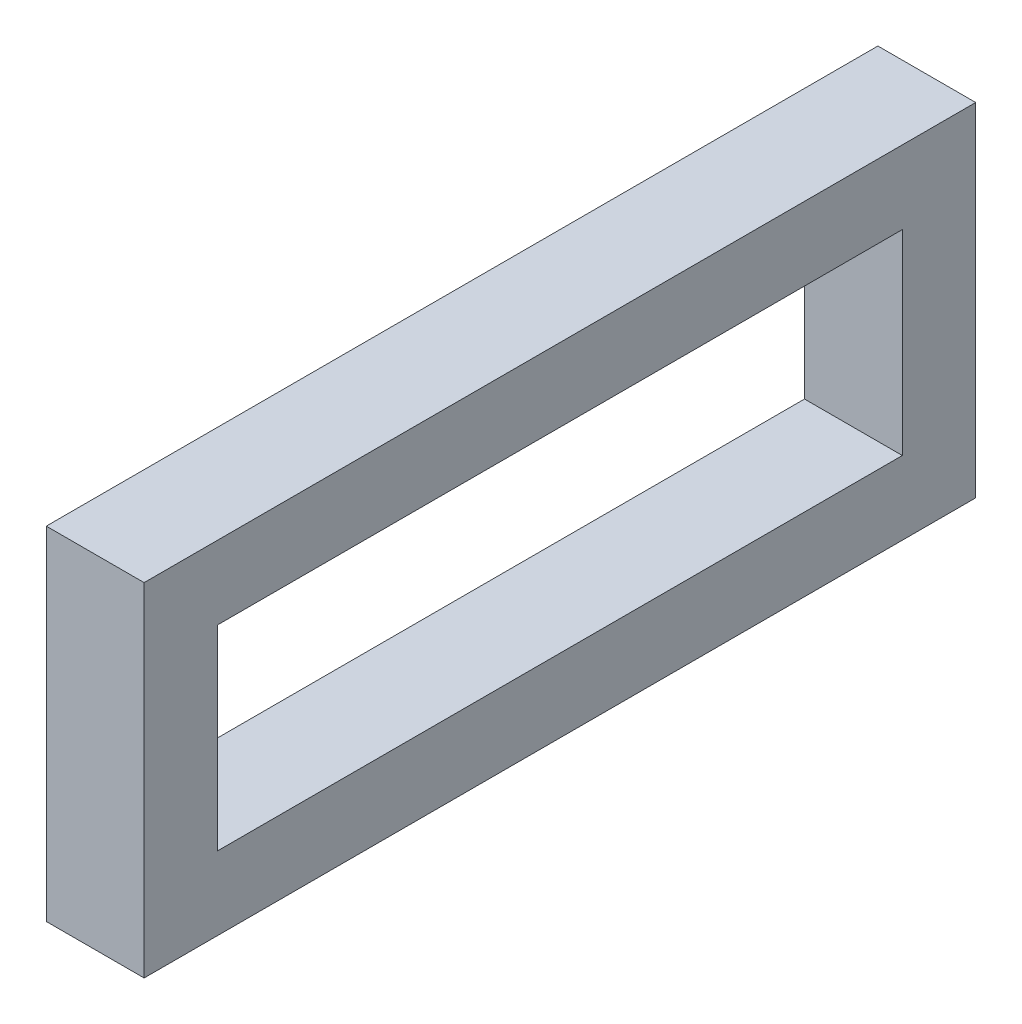
from build123d import *

# Parameters (mm, degrees)
SKETCH1_W           = 170
SKETCH1_H           = 70
SKETCH1_W_2         = 140
SKETCH1_H_2         = 40
BOSS_EXTRUDE1_DEPTH = 20


with BuildPart() as part:
    # Sketch1 → Boss-Extrude1 (new body)
    with BuildSketch(Plane(origin=(0, 0, 0), x_dir=(0, 0, -1), z_dir=(1, 0, 0))):
        Rectangle(SKETCH1_W, SKETCH1_H)
        Rectangle(SKETCH1_W_2, SKETCH1_H_2, mode=Mode.SUBTRACT)
    extrude(amount=BOSS_EXTRUDE1_DEPTH)


solid = part.part
